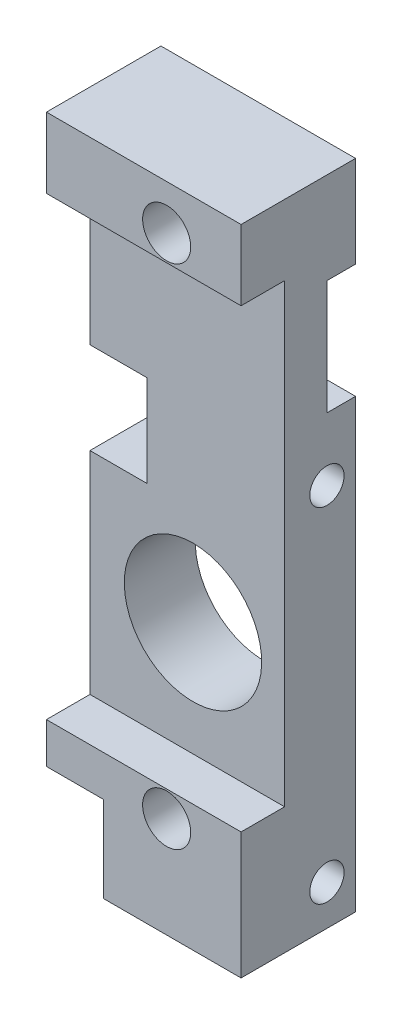
from build123d import *

# Parameters (mm, degrees)
EXTRUSION1_DEPTH                                = 8
EXTRUSION1_DEPTH_BACK                           = 9
ESQUISSE1_W                                     = 10
ESQUISSE1_H                                     = 57
ESQUISSE1_R                                     = 1.5
ESQUISSE2_R                                     = 6
ESQUISSE2_W                                     = 5
ESQUISSE2_H                                     = 8
ESQUISSE2_H_2                                   = 7.5
ENL_V_MAT_EXTRU_1_DEPTH                         = 39.431757701
ESQUISSE3_W                                     = 3.8
ESQUISSE3_H                                     = 39.8
ESQUISSE3_W_2                                   = 2.5
ESQUISSE3_H_2                                   = 10
ENL_V_MAT_EXTRU_2_DEPTH                         = 41.512343798
CHAMBRAGE_POUR_VIS_T_TE_CYLINDRIQUE_D           = 4.2
CHAMBRAGE_POUR_VIS_T_TE_CYLINDRIQUE_CBORE_D     = 7
CHAMBRAGE_POUR_VIS_T_TE_CYLINDRIQUE_CBORE_DEPTH = 4.5


with BuildPart() as part:
    # Esquisse1 → Extrusion1 (new, two sides: drawn at the far end of the back side and taken through both)
    with BuildSketch(Plane(origin=(0, 0, 0), x_dir=(0, 0, -1), z_dir=(1, 0, 0)).offset(-EXTRUSION1_DEPTH_BACK)):
        with Locations((-2.5, 7.5)):
            Rectangle(ESQUISSE1_W, ESQUISSE1_H)
        with Locations((0, 12.5)):
            Circle(ESQUISSE1_R, mode=Mode.SUBTRACT)
        with Locations((0, -17.5)):
            Circle(ESQUISSE1_R, mode=Mode.SUBTRACT)
    extrude(amount=EXTRUSION1_DEPTH + EXTRUSION1_DEPTH_BACK)

    # Esquisse2 → Enlèv. mat.-Extru.1 (cut, through all)
    with BuildSketch(Plane(origin=(0, 0, -2.5), x_dir=(-1, 0, 0), z_dir=(0, 0, -1))):
        with Locations(Location((0, 0, 0), (0, 0, 90))):
            Circle(ESQUISSE2_R)
        with Locations((6.5, 12.5)):
            Rectangle(ESQUISSE2_W, ESQUISSE2_H)
        with Locations((6.5, -17.25)):
            Rectangle(ESQUISSE2_W, ESQUISSE2_H_2)
    extrude(amount=-ENL_V_MAT_EXTRU_1_DEPTH, mode=Mode.SUBTRACT)

    # Esquisse3 → Enlèv. mat.-Extru.2 (cut, through all)
    with BuildSketch(Plane(origin=(8, 0, 0), x_dir=(0, 0, -1), z_dir=(1, 0, 0))):
        with Locations((-5.6, 9.95)):
            Rectangle(ESQUISSE3_W, ESQUISSE3_H)
        with Locations((1.25, 23)):
            Rectangle(ESQUISSE3_W_2, ESQUISSE3_H_2)
    extrude(amount=-ENL_V_MAT_EXTRU_2_DEPTH, mode=Mode.SUBTRACT)

    # Chambrage pour vis à tête cylindrique à 6 pans creux (ou vis CHC) M46 (through all)
    with Locations(Plane(origin=(0, 0, -2.5), x_dir=(-1, 0, 0), z_dir=(0, 0, -1))):
        with Locations((-1.5, -12.2), (-1.5, 32.1)):
            CounterBoreHole(CHAMBRAGE_POUR_VIS_T_TE_CYLINDRIQUE_D / 2, CHAMBRAGE_POUR_VIS_T_TE_CYLINDRIQUE_CBORE_D / 2, CHAMBRAGE_POUR_VIS_T_TE_CYLINDRIQUE_CBORE_DEPTH)


solid = part.part
